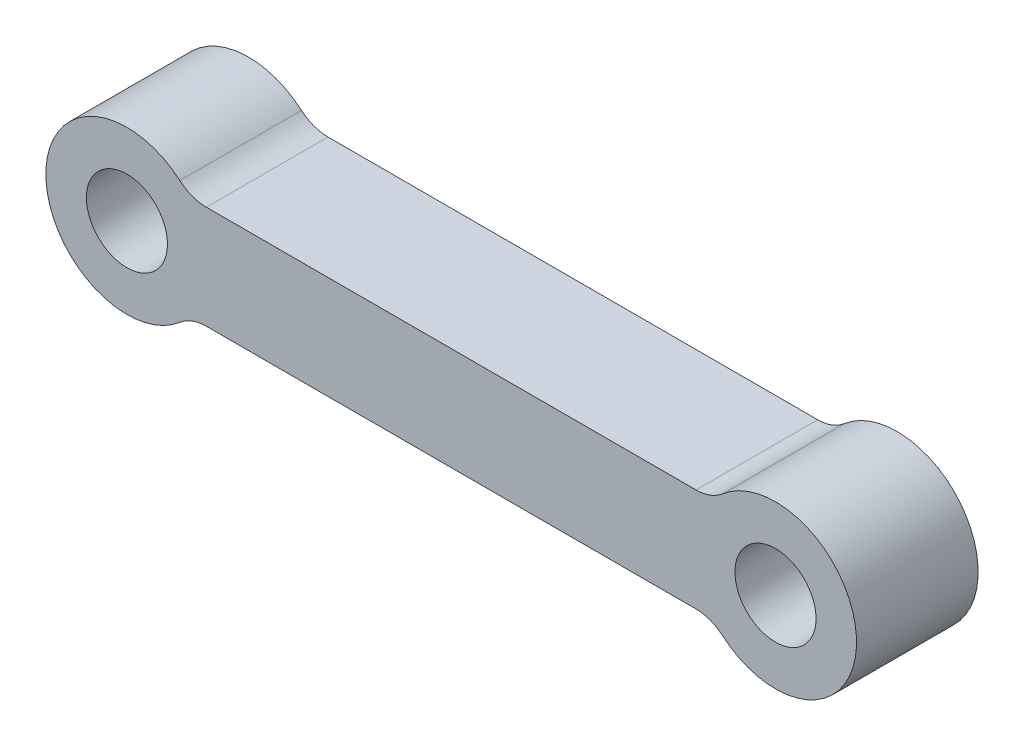
from build123d import *

# Parameters (mm, degrees)
SKETCH1_R           = 2
BOSS_EXTRUDE1_DEPTH = 6
FILLET1_R           = 2


with BuildPart() as part:
    # Sketch1 → Boss-Extrude1 (new body)
    with BuildSketch(Plane.XY):
        with BuildLine():
            Line((28.912721374, 2.543366015), (3.087278626, 2.543366015))
            ThreePointArc((3.087278626, 2.543366015), (1.706829801, 3.617558849), (0, 4))
            ThreePointArc((0, 4), (-4, 0), (0, -4))
            ThreePointArc((0, -4), (1.706829801, -3.617558849), (3.087278626, -2.543366015))
            Line((3.087278626, -2.543366015), (28.912721374, -2.543366015))
            ThreePointArc((28.912721374, -2.543366015), (30.293170199, -3.617558849), (32, -4))
            ThreePointArc((32, -4), (36, 0), (32, 4))
            ThreePointArc((32, 4), (30.293170199, 3.617558849), (28.912721374, 2.543366015))
        make_face()
        Circle(SKETCH1_R, mode=Mode.SUBTRACT)
        with Locations((32, 0)):
            Circle(SKETCH1_R, mode=Mode.SUBTRACT)
    extrude(amount=BOSS_EXTRUDE1_DEPTH)

    # Fillet1
    fillet1_edges = [part.edges().sort_by_distance(p)[0] for p in [
        (28.912721374, 2.543366015, 3),
        (28.912721374, -2.543366015, 3),
        (3.087278626, -2.543366015, 3),
        (3.087278626, 2.543366015, 3),
    ]]
    fillet(fillet1_edges, radius=FILLET1_R)


solid = part.part
